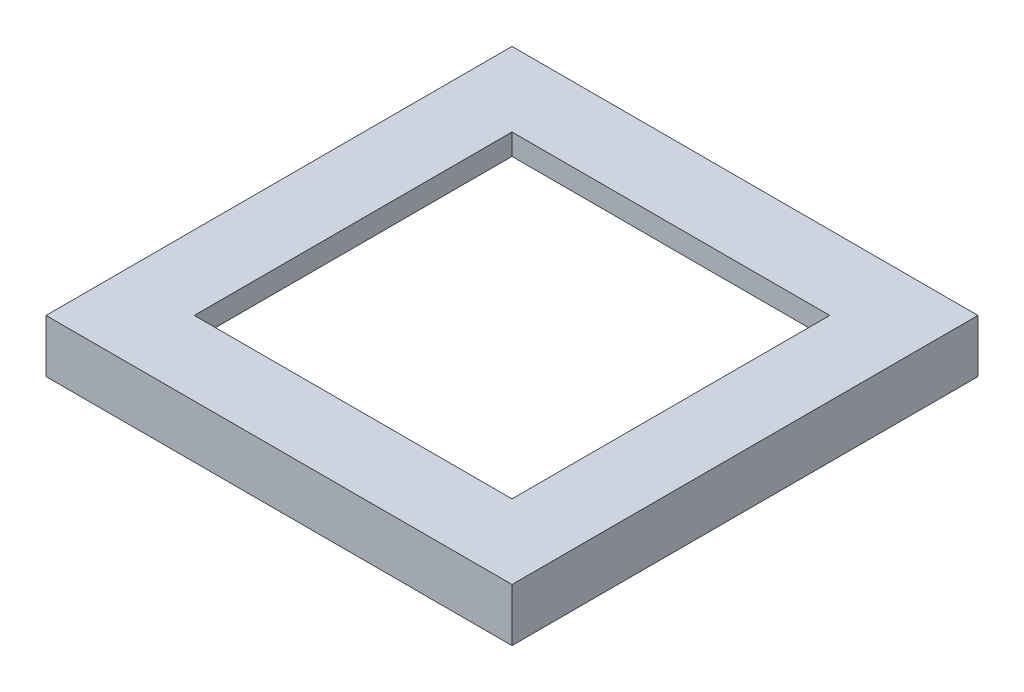
from build123d import *

# Parameters (mm, degrees)
SKETCH1_W           = 44
SKETCH1_H           = 44
BOSS_EXTRUDE1_DEPTH = 5
SKETCH3_W           = 30
SKETCH3_H           = 30
CUT_EXTRUDE1_DEPTH  = 2
SKETCH5_W           = 39
SKETCH5_H           = 39
CUT_EXTRUDE3_DEPTH  = 3


with BuildPart() as part:
    # Sketch1 → Boss-Extrude1 (new body)
    with BuildSketch(Plane(origin=(0, 0, 0), x_dir=(1, 0, 0), z_dir=(0, 1, 0))):
        Rectangle(SKETCH1_W, SKETCH1_H)
    extrude(amount=BOSS_EXTRUDE1_DEPTH)

    # Sketch3 → Cut-Extrude1 (cut)
    with BuildSketch(Plane(origin=(0, 5, 0), x_dir=(1, 0, 0), z_dir=(0, 1, 0))):
        Rectangle(SKETCH3_W, SKETCH3_H)
    extrude(amount=-CUT_EXTRUDE1_DEPTH, mode=Mode.SUBTRACT)

    # Sketch5 → Cut-Extrude3 (cut)
    with BuildSketch(Plane.XZ):
        Rectangle(SKETCH5_W, SKETCH5_H)
    extrude(amount=-CUT_EXTRUDE3_DEPTH, mode=Mode.SUBTRACT)


solid = part.part
